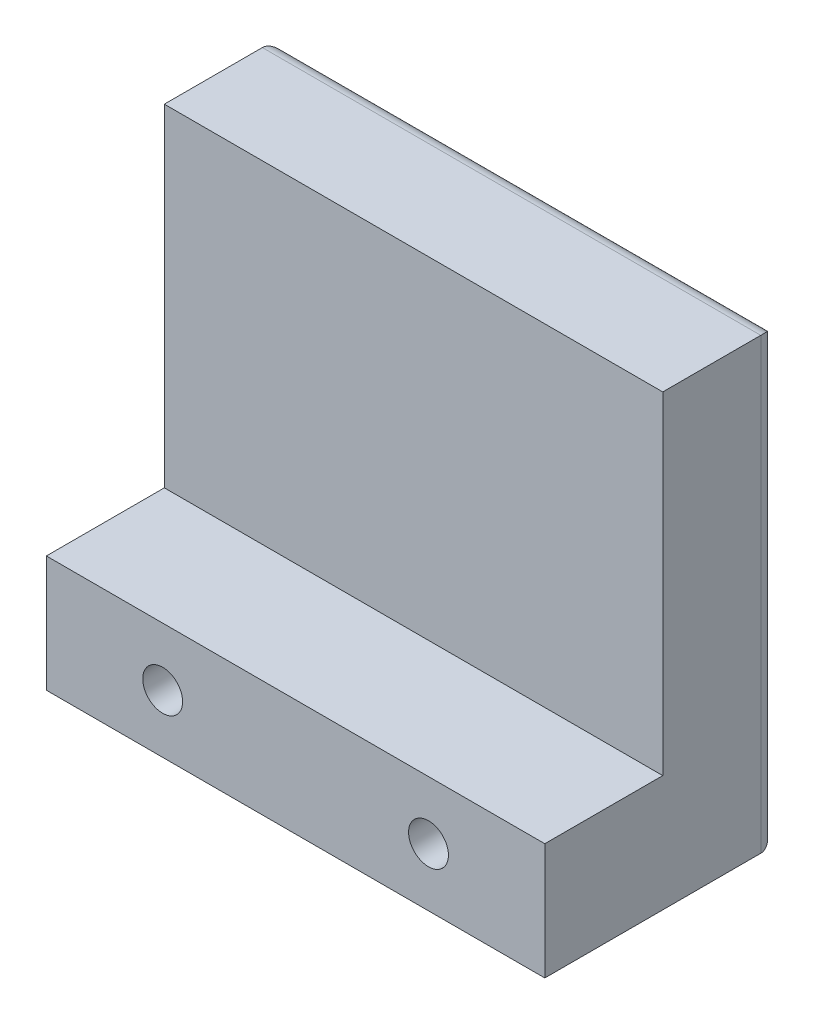
from build123d import *

# Parameters (mm, degrees)
SKETCH2_W           = 38.1
SKETCH2_H           = 17.78
BOSS_EXTRUDE1_DEPTH = 8.89
SKETCH3_W           = 38.1
SKETCH3_H           = 8.763
BOSS_EXTRUDE2_DEPTH = 25.4
SKETCH4_R           = 1.524
CUT_EXTRUDE1_DEPTH  = 44.067795393
FILLET1_R           = 1.27


with BuildPart() as part:
    # Sketch2 → Boss-Extrude1 (new body)
    with BuildSketch(Plane(origin=(0, 0, 0), x_dir=(1, 0, 0), z_dir=(0, 1, 0))):
        Rectangle(SKETCH2_W, SKETCH2_H)
    extrude(amount=BOSS_EXTRUDE1_DEPTH)

    # Sketch3 → Boss-Extrude2 (add)
    with BuildSketch(Plane(origin=(0, 8.89, 0), x_dir=(1, 0, 0), z_dir=(0, 1, 0))):
        with Locations((0, 4.5085)):
            Rectangle(SKETCH3_W, SKETCH3_H)
    extrude(amount=BOSS_EXTRUDE2_DEPTH)

    # Sketch4 → Cut-Extrude1 (cut, through all)
    with BuildSketch(Plane.XY.offset(8.89)):
        with Locations((-10.16, 4.445)):
            Circle(SKETCH4_R)
        with Locations((10.16, 4.445)):
            Circle(SKETCH4_R)
    extrude(amount=-CUT_EXTRUDE1_DEPTH, mode=Mode.SUBTRACT)

    # Fillet1
    fillet1_edges = [part.edges().sort_by_distance(p)[0] for p in [
        (0, 34.29, -8.89),
        (0, 0, -8.89),
        (-19.05, 17.145, -8.89),
        (19.05, 17.145, -8.89),
    ]]
    fillet(fillet1_edges, radius=FILLET1_R)


solid = part.part
